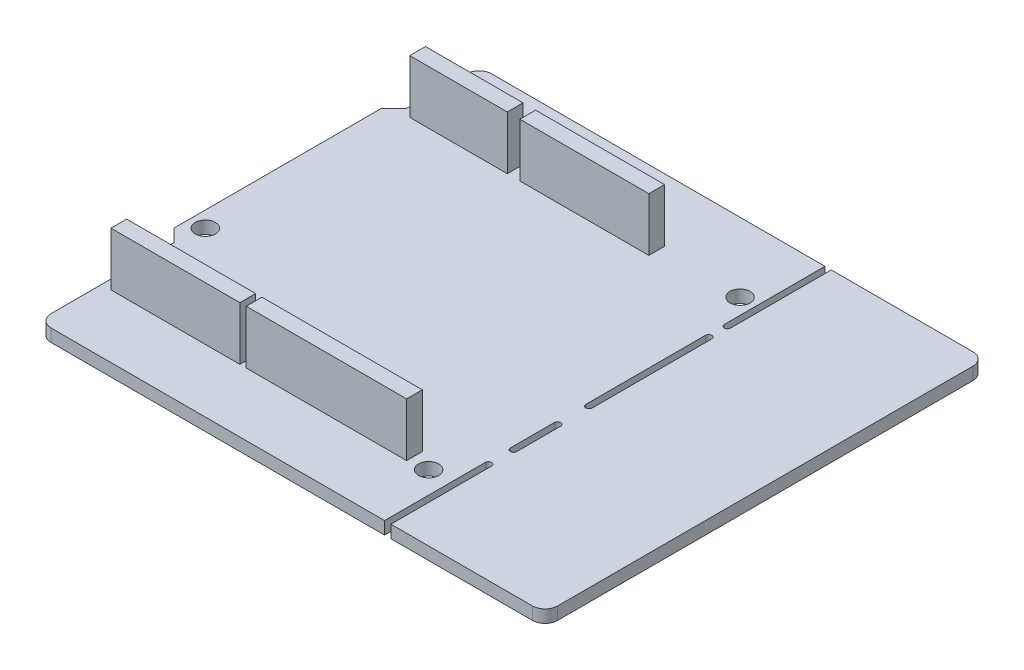
from build123d import *

# Parameters (mm, degrees)
SZKIC2_R                    = 1.6
DODANIE_WYCI_GNI_CIE1_DEPTH = 2
SZKIC3_W                    = 15.5
SZKIC3_H                    = 2.5
SZKIC3_W_2                  = 20.5
SZKIC3_W_3                  = 25.5
DODANIE_WYCI_GNI_CIE2_DEPTH = 8.5


with BuildPart() as part:
    # Szkic2 → Dodanie-wyciągnięcie1 (new body)
    with BuildSketch(Plane(origin=(0, 0, 0), x_dir=(1, 0, 0), z_dir=(0, 1, 0))):
        with BuildLine():
            Line((-43.319305218, 25.801941522), (-43.319305218, -7.198058478))
            Line((-43.319305218, -7.198058478), (-41.319305218, -9.198058478))
            Line((-41.319305218, -9.198058478), (-41.319305218, -28.698058478))
            ThreePointArc((-41.319305218, -28.698058478), (-40.73351878, -30.11227204), (-39.319305218, -30.698058478))
            Line((-39.319305218, -30.698058478), (13.680694782, -30.698058478))
            Line((13.680694782, -30.698058478), (13.680694782, -14.698058478))
            ThreePointArc((13.680694782, -14.698058478), (14.180694782, -14.198058478), (14.680694782, -14.698058478))
            Line((14.680694782, -14.698058478), (14.680694782, -30.698058478))
            Line((14.680694782, -30.698058478), (37.180694782, -30.698058478))
            ThreePointArc((37.180694782, -30.698058478), (38.594908344, -30.11227204), (39.180694782, -28.698058478))
            Line((39.180694782, -28.698058478), (39.180694782, 37.301941522))
            ThreePointArc((39.180694782, 37.301941522), (38.594908344, 38.716155084), (37.180694782, 39.301941522))
            Line((37.180694782, 39.301941522), (14.680694782, 39.301941522))
            Line((14.680694782, 39.301941522), (14.680694782, 23.301941522))
            ThreePointArc((14.680694782, 23.301941522), (14.180694782, 22.801941522), (13.680694782, 23.301941522))
            Line((13.680694782, 23.301941522), (13.680694782, 39.301941522))
            Line((13.680694782, 39.301941522), (-39.319305218, 39.301941522))
            ThreePointArc((-39.319305218, 39.301941522), (-40.73351878, 38.716155084), (-41.319305218, 37.301941522))
            Line((-41.319305218, 37.301941522), (-41.319305218, 27.801941522))
            Line((-41.319305218, 27.801941522), (-43.319305218, 25.801941522))
        make_face()
        with Locations(Location((-40.819305218, -4.698058478, 0), (0, 0, 270))):
            Circle(SZKIC2_R, mode=Mode.SUBTRACT)
        with Locations(Location((10.180694782, -20.198058478, 0), (0, 0, 270))):
            Circle(SZKIC2_R, mode=Mode.SUBTRACT)
        with BuildLine():
            ThreePointArc((13.680694782, -3.698058478), (14.180694782, -3.198058478), (14.680694782, -3.698058478))
            Line((14.680694782, -3.698058478), (14.680694782, -10.698058478))
            ThreePointArc((14.680694782, -10.698058478), (14.180694782, -11.198058478), (13.680694782, -10.698058478))
            Line((13.680694782, -10.698058478), (13.680694782, -3.698058478))
        make_face(mode=Mode.SUBTRACT)
        with BuildLine():
            ThreePointArc((13.680694782, 20.301941522), (14.180694782, 20.801941522), (14.680694782, 20.301941522))
            Line((14.680694782, 20.301941522), (14.680694782, 1.301941522))
            ThreePointArc((14.680694782, 1.301941522), (14.180694782, 0.801941522), (13.680694782, 1.301941522))
            Line((13.680694782, 1.301941522), (13.680694782, 20.301941522))
        make_face(mode=Mode.SUBTRACT)
        with Locations(Location((11.180694782, 28.301941522, 0), (0, 0, 270))):
            Circle(SZKIC2_R, mode=Mode.SUBTRACT)
    extrude(amount=DODANIE_WYCI_GNI_CIE1_DEPTH)

    # Szkic3 → Dodanie-wyciągnięcie2 (add)
    with BuildSketch(Plane(origin=(0, 2, 0), x_dir=(1, 0, 0), z_dir=(0, 1, 0))):
        with Locations((-32.069305218, 28.051941522)):
            Rectangle(SZKIC3_W, SZKIC3_H)
        with Locations((-12.069305218, 28.051941522)):
            Rectangle(SZKIC3_W_2, SZKIC3_H)
        with Locations((-29.569305218, -19.448058478)):
            Rectangle(SZKIC3_W_2, SZKIC3_H)
        with Locations((-5.569305218, -19.448058478)):
            Rectangle(SZKIC3_W_3, SZKIC3_H)
    extrude(amount=DODANIE_WYCI_GNI_CIE2_DEPTH)


solid = part.part
